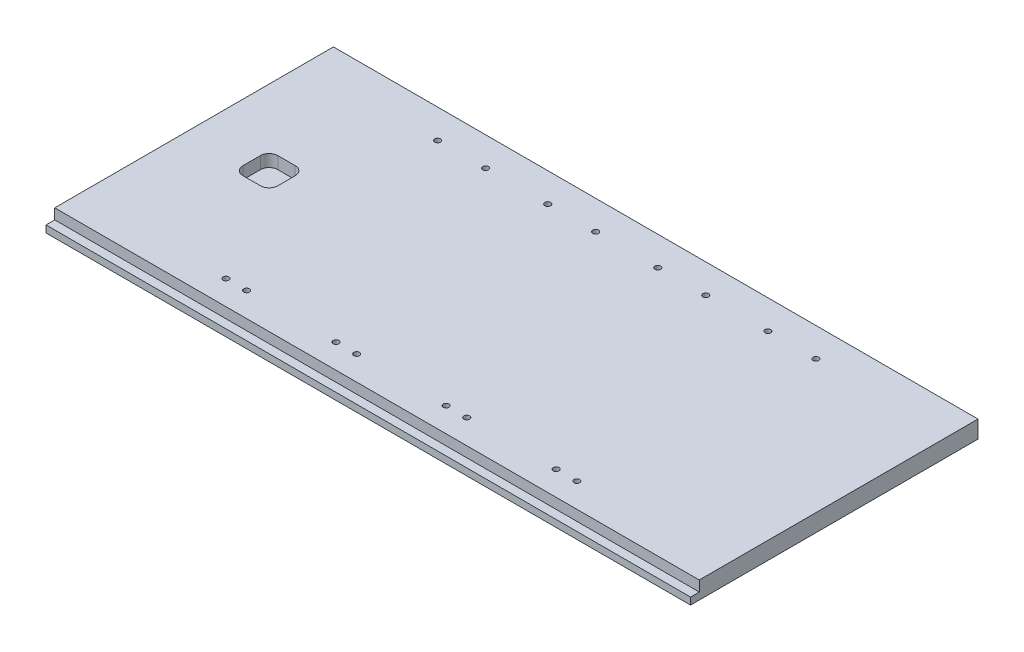
from build123d import *

# Parameters (mm, degrees)
SKETCH3_W           = 469.9
SKETCH3_H           = 209.55
BOSS_EXTRUDE1_DEPTH = 12.7
SKETCH4_R           = 2.1
CUT_EXTRUDE3_DEPTH  = 258.566677047
SKETCH5_R           = 2.1
CUT_EXTRUDE4_DEPTH  = 258.566677047
SKETCH7_W           = 25.4
SKETCH7_H           = 25.4
CUT_EXTRUDE5_DEPTH  = 8.89
CUT_EXTRUDE6_REACH  = 483.607
SKETCH8_W           = 6.35
SKETCH8_H           = 7.62
FILLET1_R           = 6.35


with BuildPart() as part:
    # Sketch3 → Boss-Extrude1 (new body)
    with BuildSketch(Plane(origin=(0, 0, 0), x_dir=(1, 0, 0), z_dir=(0, 1, 0))):
        Rectangle(SKETCH3_W, SKETCH3_H)
    extrude(amount=BOSS_EXTRUDE1_DEPTH)

    # Sketch4 → Cut-Extrude3 (cut, through all)
    with BuildSketch(Plane(origin=(0, 12.7, 0), x_dir=(1, 0, 0), z_dir=(0, 1, 0))):
        with Locations(Location((-102.9, 83.65, 0), (0, 0, 270))):
            Circle(SKETCH4_R)
        with Locations(Location((-22.65, 83.65, 0), (0, 0, 270))):
            Circle(SKETCH4_R)
        with Locations(Location((57.6, 83.65, 0), (0, 0, 270))):
            Circle(SKETCH4_R)
        with Locations(Location((137.85, 83.65, 0), (0, 0, 270))):
            Circle(SKETCH4_R)
        with Locations(Location((112.85, -80.65, 0), (0, 0, 270))):
            Circle(SKETCH4_R)
        with Locations(Location((32.6, -80.65, 0), (0, 0, 270))):
            Circle(SKETCH4_R)
        with Locations(Location((-47.65, -80.65, 0), (0, 0, 270))):
            Circle(SKETCH4_R)
        with Locations(Location((-127.9, -80.65, 0), (0, 0, 270))):
            Circle(SKETCH4_R)
    extrude(amount=-CUT_EXTRUDE3_DEPTH, mode=Mode.SUBTRACT)

    # Sketch5 → Cut-Extrude4 (cut, through all)
    with BuildSketch(Plane(origin=(0, 12.7, 0), x_dir=(1, 0, 0), z_dir=(0, 1, 0))):
        with Locations(Location((-137.85, 83.65, 0), (0, 0, 270))):
            Circle(SKETCH5_R)
        with Locations(Location((-57.6, 83.65, 0), (0, 0, 270))):
            Circle(SKETCH5_R)
        with Locations(Location((22.65, 83.65, 0), (0, 0, 270))):
            Circle(SKETCH5_R)
        with Locations(Location((102.9, 83.65, 0), (0, 0, 270))):
            Circle(SKETCH5_R)
        with Locations(Location((-112.85, -80.65, 0), (0, 0, 270))):
            Circle(SKETCH5_R)
        with Locations(Location((-32.6, -80.65, 0), (0, 0, 270))):
            Circle(SKETCH5_R)
        with Locations(Location((47.65, -80.65, 0), (0, 0, 270))):
            Circle(SKETCH5_R)
        with Locations(Location((127.9, -80.65, 0), (0, 0, 270))):
            Circle(SKETCH5_R)
    extrude(amount=-CUT_EXTRUDE4_DEPTH, mode=Mode.SUBTRACT)

    # Sketch7 → Cut-Extrude5 (cut)
    with BuildSketch(Plane(origin=(0, 12.7, 0), x_dir=(1, 0, 0), z_dir=(0, 1, 0))):
        with Locations((-180.25, 3.175)):
            Rectangle(SKETCH7_W, SKETCH7_H)
    extrude(amount=-CUT_EXTRUDE5_DEPTH, mode=Mode.SUBTRACT)

    # Sketch8 → Cut-Extrude6 (cut, up to next)
    with BuildSketch(Plane.ZY.offset(234.95), mode=Mode.PRIVATE) as cut_extrude6_sk1:
        with Locations((101.6, 8.89)):
            Rectangle(SKETCH8_W, SKETCH8_H)
    cut_extrude6_tool1 = extrude(cut_extrude6_sk1.sketch, amount=-CUT_EXTRUDE6_REACH, mode=Mode.PRIVATE) & part.part
    add(cut_extrude6_tool1.solids().sort_by_distance((-234.95, 8.89, 101.6))[0], mode=Mode.SUBTRACT)

    # Fillet1
    fillet1_edges = [part.edges().sort_by_distance(p)[0] for p in [
        (-167.55, 8.255, -15.875),
        (-167.55, 8.255, 9.525),
        (-192.95, 8.255, 9.525),
        (-192.95, 8.255, -15.875),
    ]]
    fillet(fillet1_edges, radius=FILLET1_R)


solid = part.part
